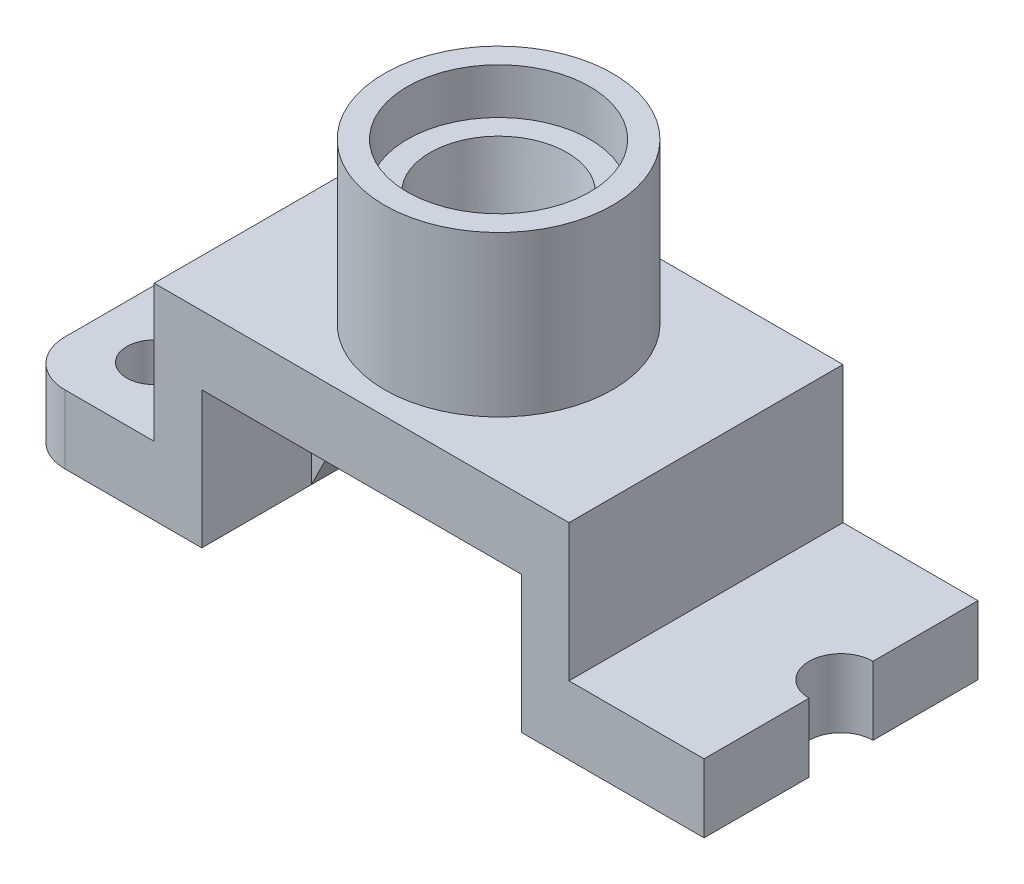
from build123d import *

# Parameters (mm, degrees)
BOSS_EXTRUDE1_DEPTH = 30
BOSS_EXTRUDE2_DEPTH = 6
SKETCH3_R           = 6
CUT_EXTRUDE1_DEPTH  = 87.168439698
FILLET1_R           = 10
SKETCH4_R           = 7
CUT_EXTRUDE2_DEPTH  = 22
SKETCH5_R           = 25
BOSS_EXTRUDE3_DEPTH = 35
SKETCH6_R           = 20
CUT_EXTRUDE3_DEPTH  = 10
SKETCH7_R           = 15
SKETCH8_R           = 10


with BuildPart() as part:
    # Sketch1 → Boss-Extrude1 (new, symmetric)
    with BuildSketch(Plane.XY):
        Polygon((-75, 0), (-35, 0), (-35, 30), (35, 30), (35, 0), (75, 0), (75, 15), (45.422535211, 15), (45.422535211, 45), (-45.422535211, 45), (-45.422535211, 15), (-75, 15), align=None)
    extrude(amount=BOSS_EXTRUDE1_DEPTH, both=True)

    # Sketch2 → Boss-Extrude2 (add, symmetric)
    with BuildSketch(Plane.XY):
        Polygon((-35, 0), (-35, 30), (-20, 30), align=None)
        Polygon((20, 30), (35, 30), (35, 0), align=None)
    extrude(amount=BOSS_EXTRUDE2_DEPTH, both=True)

    # Sketch3 → Cut-Extrude1 (cut, through all)
    with BuildSketch(Plane(origin=(0, 15, 0), x_dir=(1, 0, 0), z_dir=(0, 1, 0))):
        with Locations(Location((-60.422535211, -15, 0), (0, 0, 180))):
            Circle(SKETCH3_R)
        with Locations(Location((-60.422535211, 15, 0), (0, 0, 180))):
            Circle(SKETCH3_R)
    extrude(amount=-CUT_EXTRUDE1_DEPTH, mode=Mode.SUBTRACT)

    # Fillet1
    fillet1_edges = [part.edges().sort_by_distance(p)[0] for p in [
        (-75, 7.5, -30),
        (-75, 7.5, 30),
    ]]
    fillet(fillet1_edges, radius=FILLET1_R)

    # Sketch4 → Cut-Extrude2 (cut)
    with BuildSketch(Plane(origin=(0, 15, 0), x_dir=(1, 0, 0), z_dir=(0, 1, 0))):
        with Locations((75, 0)):
            Circle(SKETCH4_R)
    extrude(amount=-CUT_EXTRUDE2_DEPTH, mode=Mode.SUBTRACT)

    # Sketch5 → Boss-Extrude3 (add)
    with BuildSketch(Plane(origin=(0, 45, 0), x_dir=(1, 0, 0), z_dir=(0, 1, 0))):
        with Locations(Location((0, 0, 0), (0, 0, 270))):
            Circle(SKETCH5_R)
    extrude(amount=BOSS_EXTRUDE3_DEPTH)

    # Sketch6 → Cut-Extrude3 (cut)
    with BuildSketch(Plane(origin=(0, 80, 0), x_dir=(1, 0, 0), z_dir=(0, 1, 0))):
        with Locations(Location((0, 0, 0), (0, 0, 270))):
            Circle(SKETCH6_R)
    extrude(amount=-CUT_EXTRUDE3_DEPTH, mode=Mode.SUBTRACT)

    # Sketch7 → Cut-Loft1 section 0
    with BuildSketch(Plane(origin=(0, 70, 0), x_dir=(1, 0, 0), z_dir=(0, 1, 0))):
        Circle(SKETCH7_R)
    # Sketch8 → Cut-Loft1 section 1
    with BuildSketch(Plane.XZ.offset(-30)):
        Circle(SKETCH8_R)
    loft(mode=Mode.SUBTRACT)


solid = part.part
